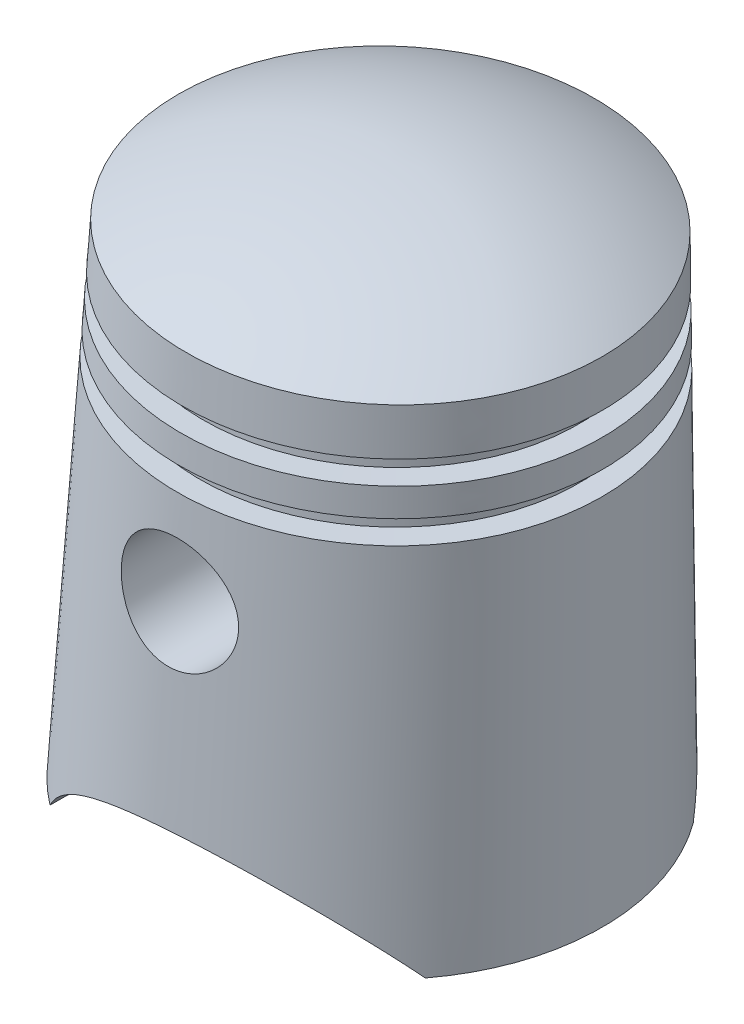
from build123d import *

# Parameters (mm, degrees)
WYTNIJ_WYCI_GNI_CIE1_DEPTH      = 71.239050733
WYTNIJ_WYCI_GNI_CIE1_DEPTH_BACK = 71.239050733
SZKIC7_R                        = 6
DODANIE_WYCI_GNI_CIE2_REACH     = 82.239
DODANIE_WYCI_GNI_CIE2_START     = -10
SZKIC8_R                        = 7.5
SZKIC8_R_2                      = 6
WYTNIJ_WYCI_GNI_CIE2_DEPTH      = 71.239050806
WYTNIJ_WYCI_GNI_CIE2_DEPTH_BACK = 71.239050806


with BuildPart() as part:
    # Szkic2 → Obrót2 (revolve)
    with BuildSketch(Plane.XY, mode=Mode.PRIVATE) as obr_t2_sk:
        with BuildLine():
            Line((22.5, 53), (22.5, 48))
            Line((22.5, 48), (20, 48))
            Line((20, 48), (20, 45.5))
            Line((20, 45.5), (22.5, 45.5))
            Line((22.5, 45.5), (22.5, 42.5))
            Line((22.5, 42.5), (20, 42.5))
            Line((20, 42.5), (20, 40))
            Line((20, 40), (22.5, 40))
            Line((22.5, 40), (22.5, 0))
            Line((22.5, 0), (20.5, 0))
            Line((20.5, 0), (20.5, 38))
            Line((20.5, 38), (18, 38))
            Line((18, 38), (18, 44))
            Line((18, 44), (18, 50))
            Line((18, 50), (20.5, 50))
            Line((20.5, 50), (20.5, 51.885486613))
            ThreePointArc((20.5, 51.885486613), (10.601017561, 56.247690182), (-0.073407897, 58.001347634))
            Line((-0.073407897, 58.001347634), (0, 60))
            ThreePointArc((0, 60), (11.716317194, 57.998876697), (22.5, 53))
        make_face()
    revolve(obr_t2_sk.sketch.rotate(Axis((0, 60, 0), (-0.0367039483145182, -0.999326183074438, 0)), 180), axis=Axis((0, 60, 0), (-0.0367039483145182, -0.999326183074438, 0)))

    # Szkic7 → Wytnij-wyciągnięcie1 (cut, two sides: drawn at the far end of the back side and taken through both)
    with BuildSketch(Plane.XY.offset(-WYTNIJ_WYCI_GNI_CIE1_DEPTH_BACK)):
        with Locations(Location((0, 30.727831222, 0), (0, 0, 235.880183529))):
            Circle(SZKIC7_R)
    extrude(amount=WYTNIJ_WYCI_GNI_CIE1_DEPTH + WYTNIJ_WYCI_GNI_CIE1_DEPTH_BACK, mode=Mode.SUBTRACT)

    # Dodanie-wyciągnięcie2: up to this cone (the profile starts inside it)
    dodanie_wyci_gni_cie2_end = Plane(origin=(-1.083498295, 30.499952587, 0), z_dir=(-0.0367039483145182, -0.999326183074438, 0)) * Cone(17.765887508, 25.430215347, 208.674102855, mode=Mode.PRIVATE)
    # Szkic8 → Dodanie-wyciągnięcie2 (add, up to the surface)
    with BuildSketch(Plane.XY.offset(DODANIE_WYCI_GNI_CIE2_START), mode=Mode.PRIVATE) as dodanie_wyci_gni_cie2_sk1:
        with Locations((0, 30.727831222)):
            Circle(SZKIC8_R)
        with Locations(Location((0, 30.727831222, 0), (0, 0, 235.880183529))):
            Circle(SZKIC8_R_2, mode=Mode.SUBTRACT)
    dodanie_wyci_gni_cie2_tool1 = extrude(dodanie_wyci_gni_cie2_sk1.sketch, amount=-DODANIE_WYCI_GNI_CIE2_REACH, mode=Mode.PRIVATE) & dodanie_wyci_gni_cie2_end
    dodanie_wyci_gni_cie2 = dodanie_wyci_gni_cie2_tool1.solids().sort_by_distance((-7.287868, 30.727831, -10))[0]
    add(dodanie_wyci_gni_cie2)

    # Lustro1: Dodanie-wyciągnięcie2 across plane
    add(dodanie_wyci_gni_cie2.mirror(Plane.XY))

    # Szkic5 → Wytnij-wyciągnięcie2 (cut, two sides: drawn at the far end of the back side and taken through both)
    with BuildSketch(Plane.XY.offset(-WYTNIJ_WYCI_GNI_CIE2_DEPTH_BACK)):
        with BuildLine():
            Line((18, 0), (-18, 0))
            ThreePointArc((-18, 0), (0, 10), (18, 0))
        make_face()
    extrude(amount=WYTNIJ_WYCI_GNI_CIE2_DEPTH + WYTNIJ_WYCI_GNI_CIE2_DEPTH_BACK, mode=Mode.SUBTRACT)


solid = part.part
